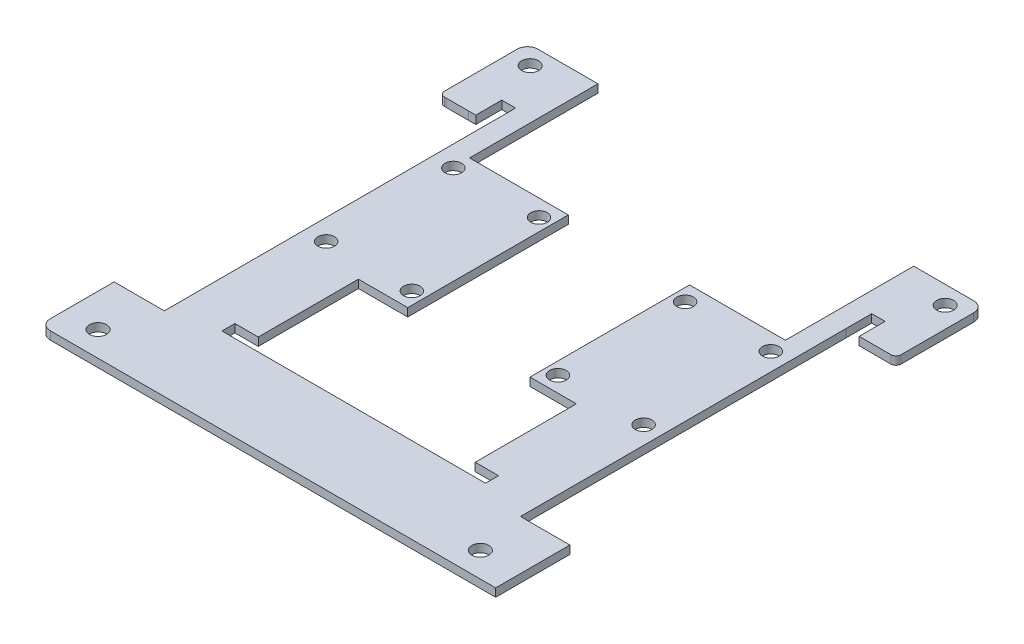
from build123d import *

# Parameters (mm, degrees)
SKETCH1_2_R                 = 1.6383
BOSS_EXTRUDE2_DEPTH         = 1.575
SKETCH2_W                   = 14.080651801
SKETCH2_H                   = 7.11628052
SKETCH2_W_2                 = 15.007196354
SKETCH2_H_2                 = 9.421332762
CUT_EXTRUDE1_DEPTH          = 65.400942629
ADDITIONAL_PCB_MATERIAL_W   = 2.649520344
ADDITIONAL_PCB_MATERIAL_H   = 65.213315835
ADDITIONAL_PCB_MATERIAL_W_2 = 1.5
ADDITIONAL_PCB_MATERIAL_H_2 = 65.299191064
BOSS_EXTRUDE3_DEPTH         = 1.575
SKETCH3_W                   = 46.818
SKETCH3_H                   = 1
BOSS_EXTRUDE4_DEPTH         = 1.575
SKETCH4_W                   = 2
SKETCH4_H                   = 2.5
CUT_EXTRUDE2_DEPTH          = 65.400942629
SKETCH5_W                   = 2.5
SKETCH5_H                   = 18.09999695
SKETCH5_H_2                 = 19.499999394
BOSS_EXTRUDE5_DEPTH         = 1.575
SKETCH7_W                   = 9.5
SKETCH7_H                   = 1.20600305
CUT_EXTRUDE3_DEPTH          = 65.400942629
M3_CLEARANCE_HOLE1_D        = 3.2
M3_CLEARANCE_HOLE2_D        = 3.2
M3_CLEARANCE_HOLE3_D        = 3.2
M3_CLEARANCE_HOLE4_D        = 3.2
M3_CLEARANCE_HOLE5_D        = 3.2
SKETCH26_W                  = 2.575
SKETCH26_H                  = 5
CUT_EXTRUDE4_DEPTH          = 10


with BuildPart() as part:
    # Sketch1<2> → Boss-Extrude2 (new body)
    with BuildSketch(Plane(origin=(0, 0, 0), x_dir=(1, 0, 0), z_dir=(0, 1, 0))):
        with BuildLine():
            Line((-38.39500299, 29.999999735), (-42.73000299, 29.999999735))
            Line((-42.73000299, 29.999999735), (-43.011025994, 30.003097626))
            ThreePointArc((-43.011025994, 30.003097626), (-43.710996344, 30.299838092), (-44.000003042, 31.003036872))
            Line((-44.000003042, 31.003036872), (-44.000003042, 31.269999735))
            Line((-44.000003042, 31.269999735), (-44.000005679, 44.999999735))
            ThreePointArc((-44.000005679, 44.999999735), (-43.414218633, 46.414215608), (-42.000002924, 47.000003051))
            Line((-42.000002924, 47.000003051), (-30.435003, 47.000003051))
            Line((-30.435003, 47.000003051), (-30.435003, 22.255357341))
            Line((-30.435003, 22.255357341), (-11.409003, 22.255357341))
            Line((-11.409003, 22.255357341), (-11.409003, -9.899999999))
            Line((-11.409003, -9.899999999), (-23.409003, -9.899999999))
            Line((-23.409003, -9.899999999), (-23.409003, -31.499996949))
            Line((-23.409003, -31.499996949), (23.408997, -31.499996949))
            Line((23.408997, -31.499996949), (23.408997, -8.499997555))
            Line((23.408997, -8.499997555), (11.97084713, -8.499997555))
            Line((11.97084713, -8.499997555), (11.97084713, 22.255357341))
            Line((11.97084713, 22.255357341), (30.434997, 22.255357341))
            Line((30.434997, 22.255357341), (30.434997, 47.000003051))
            Line((30.434997, 47.000003051), (42.000008541, 47.000003051))
            ThreePointArc((42.000008541, 47.000003051), (43.414213215, 46.414220704), (43.999996956, 45.000016607))
            Line((43.999996956, 45.000016607), (43.999996956, 32.000003378))
            Line((43.999996956, 32.000003378), (43.999996956, 31.015615364))
            ThreePointArc((43.999996956, 31.015615364), (43.706534093, 30.307939396), (42.998386406, 30.015616661))
            Line((42.998386406, 30.015616661), (33.825607551, 30.030389905))
            ThreePointArc((33.825607551, 30.030389905), (33.117459864, 29.738067169), (32.823997, 29.030391202))
            Line((32.823997, 29.030391202), (32.823997, -30.453996949))
            ThreePointArc((32.823997, -30.453996949), (33.116890219, -31.16110373), (33.823997, -31.453996949))
            Line((33.823997, -31.453996949), (36.099999555, -31.453996949))
            Line((36.099999555, -31.453996949), (42.849728118, -31.453996949))
            ThreePointArc((42.849728118, -31.453996949), (43.556834899, -31.746890168), (43.849728118, -32.453996949))
            Line((43.849728118, -32.453996949), (43.849728118, -36.999996949))
            Line((43.849728118, -36.999996949), (43.849728118, -46.999996949))
            Line((43.849728118, -46.999996949), (-42.000000178, -46.999996949))
            ThreePointArc((-42.000000178, -46.999996949), (-43.414212804, -46.414211581), (-44.000000499, -44.999999921))
            Line((-44.000000499, -44.999999921), (-44.000000178, -38.976999921))
            Line((-44.000000178, -38.976999921), (-44.000000178, -32.453999802))
            ThreePointArc((-44.000000178, -32.453999802), (-43.70710696, -31.746893021), (-43.000000178, -31.453999802))
            Line((-43.000000178, -31.453999802), (-36.100000549, -31.453999802))
            Line((-36.100000549, -31.453999802), (-33.824003042, -31.453999802))
            ThreePointArc((-33.824003042, -31.453999802), (-33.116896261, -31.161106583), (-32.824003042, -30.453999802))
            Line((-32.824003042, -30.453999802), (-32.824003042, 29.011483943))
            ThreePointArc((-32.824003042, 29.011483943), (-33.117785331, 29.719478678), (-33.826516131, 30.011480785))
            Line((-33.826516131, 30.011480785), (-38.39500299, 29.999999735))
        make_face()
        with Locations((40, 43.5)):
            Circle(SKETCH1_2_R, mode=Mode.SUBTRACT)
        with Locations((-40, 43.5)):
            Circle(SKETCH1_2_R, mode=Mode.SUBTRACT)
        with Locations((-37.6, -42.2)):
            Circle(SKETCH1_2_R, mode=Mode.SUBTRACT)
        with Locations((36.1, -42.2)):
            Circle(SKETCH1_2_R, mode=Mode.SUBTRACT)
    extrude(amount=BOSS_EXTRUDE2_DEPTH)

    # Sketch2 → Cut-Extrude1 (cut, through all)
    with BuildSketch(Plane(origin=(0, 1.575, 0), x_dir=(1, 0, 0), z_dir=(0, 1, 0))):
        with Locations((39.863054019, -29.135856689)):
            Rectangle(SKETCH2_W, SKETCH2_H)
        with Locations((-40.336598676, -27.983330568)):
            Rectangle(SKETCH2_W_2, SKETCH2_H_2)
    extrude(amount=-CUT_EXTRUDE1_DEPTH, mode=Mode.SUBTRACT)

    # Additional PCB material → Boss-Extrude3 (add)
    with BuildSketch(Plane(origin=(0, 1.575, 0), x_dir=(1, 0, 0), z_dir=(0, 1, 0))):
        with Locations((32.999236828, -1.128517583)):
            Rectangle(ADDITIONAL_PCB_MATERIAL_W, ADDITIONAL_PCB_MATERIAL_H)
        with Locations((-33.574003042, -1.085579968)):
            Rectangle(ADDITIONAL_PCB_MATERIAL_W_2, ADDITIONAL_PCB_MATERIAL_H_2)
    extrude(amount=-BOSS_EXTRUDE3_DEPTH)

    # Sketch3 → Boss-Extrude4 (add)
    with BuildSketch(Plane(origin=(0, 1.575, 0), x_dir=(1, 0, 0), z_dir=(0, 1, 0))):
        with Locations((-3e-06, -30.999996949)):
            Rectangle(SKETCH3_W, SKETCH3_H)
    extrude(amount=-BOSS_EXTRUDE4_DEPTH)

    # Sketch4 → Cut-Extrude2 (cut, through all)
    with BuildSketch(Plane(origin=(0, 1.575, 0), x_dir=(1, 0, 0), z_dir=(0, 1, 0))):
        with Locations((24.408997, -29.249996949)):
            Rectangle(SKETCH4_W, SKETCH4_H)
        with Locations((-24.409003, -29.249996949)):
            Rectangle(SKETCH4_W, SKETCH4_H)
    extrude(amount=-CUT_EXTRUDE2_DEPTH, mode=Mode.SUBTRACT)

    # Sketch5 → Boss-Extrude5 (add)
    with BuildSketch(Plane(origin=(0, 1.575, 0), x_dir=(1, 0, 0), z_dir=(0, 1, 0))):
        with Locations((-22.159003, -18.949998474)):
            Rectangle(SKETCH5_W, SKETCH5_H)
        with Locations((22.158997, -18.249997252)):
            Rectangle(SKETCH5_W, SKETCH5_H_2)
    extrude(amount=-BOSS_EXTRUDE5_DEPTH)

    # Sketch7 → Cut-Extrude3 (cut, through all)
    with BuildSketch(Plane(origin=(0, 1.575, 0), x_dir=(1, 0, 0), z_dir=(0, 1, 0))):
        with Locations((-16.159003, -9.296998474)):
            Rectangle(SKETCH7_W, SKETCH7_H)
    extrude(amount=-CUT_EXTRUDE3_DEPTH, mode=Mode.SUBTRACT)

    # M3 Clearance Hole1 (through all)
    with Locations(Plane(origin=(-37.357724691, 1.575, 48.235847646), x_dir=(-1, 0, 0), z_dir=(0, 1, 0))):
        with Locations((-23.558721691, -42.724316051), (-23.558721691, -67.244316051), (-7.038721691, -67.244316051), (-7.038721691, -42.724316051)):
            Hole(M3_CLEARANCE_HOLE1_D / 2)

    # M3 Clearance Hole2 (through all)
    with Locations(Plane(origin=(-37.357724691, 1.575, 48.235847646), x_dir=(-1, 0, 0), z_dir=(0, 1, 0))):
        with Locations((-51.71857182, -42.724316051)):
            Hole(M3_CLEARANCE_HOLE2_D / 2)

    # M3 Clearance Hole3 (through all)
    with Locations(Plane(origin=(-37.357724691, 1.575, 48.235847646), x_dir=(-1, 0, 0), z_dir=(0, 1, 0))):
        with Locations((-68.23857182, -42.724316051)):
            Hole(M3_CLEARANCE_HOLE3_D / 2)

    # M3 Clearance Hole4 (through all)
    with Locations(Plane(origin=(-37.357724691, 21.15, 48.235847646), x_dir=(-1, 0, 0), z_dir=(0, 1, 0))):
        with Locations((-51.71857182, -67.244316051)):
            Hole(M3_CLEARANCE_HOLE4_D / 2)

    # M3 Clearance Hole5 (through all)
    with Locations(Plane(origin=(-37.357724691, 1.575, 48.235847646), x_dir=(-1, 0, 0), z_dir=(0, 1, 0))):
        with Locations((-68.23857182, -67.244316051)):
            Hole(M3_CLEARANCE_HOLE5_D / 2)

    # Sketch26 → Cut-Extrude4 (cut)
    with BuildSketch(Plane(origin=(0, 1.575, 0), x_dir=(1, 0, 0), z_dir=(0, 1, 0))):
        Polygon((-36.984003042, 35.010230552), (-34.324003042, 35.010230552), (-34.324003042, 29.927765717), (-36.984003042, 29.927765717), (-36.984003042, 30.010230552), align=None)
        with Locations((35.612496956, 32.515616661)):
            Rectangle(SKETCH26_W, SKETCH26_H)
    extrude(amount=-CUT_EXTRUDE4_DEPTH, mode=Mode.SUBTRACT)


solid = part.part
